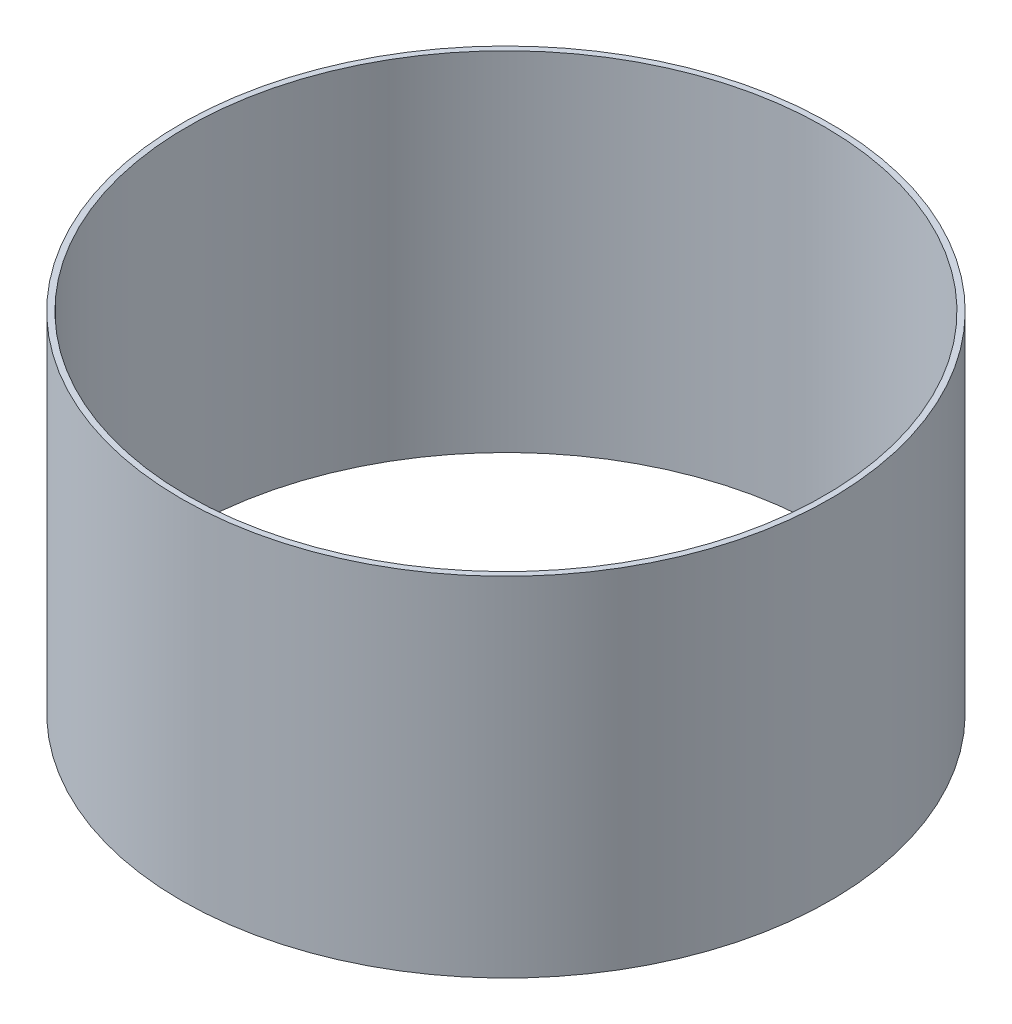
from build123d import *

# Parameters (mm, degrees)
SKETCH1_R           = 280
SKETCH1_R_2         = 275
BOSS_EXTRUDE1_DEPTH = 300


with BuildPart() as part:
    # Sketch1 → Boss-Extrude1 (new body)
    with BuildSketch(Plane(origin=(0, 0, 0), x_dir=(1, 0, 0), z_dir=(0, 1, 0))):
        with Locations(Location((0, 0, 0), (0, 0, 270))):
            Circle(SKETCH1_R)
        with Locations(Location((0, 0, 0), (0, 0, 270))):
            Circle(SKETCH1_R_2, mode=Mode.SUBTRACT)
    extrude(amount=BOSS_EXTRUDE1_DEPTH)


solid = part.part
